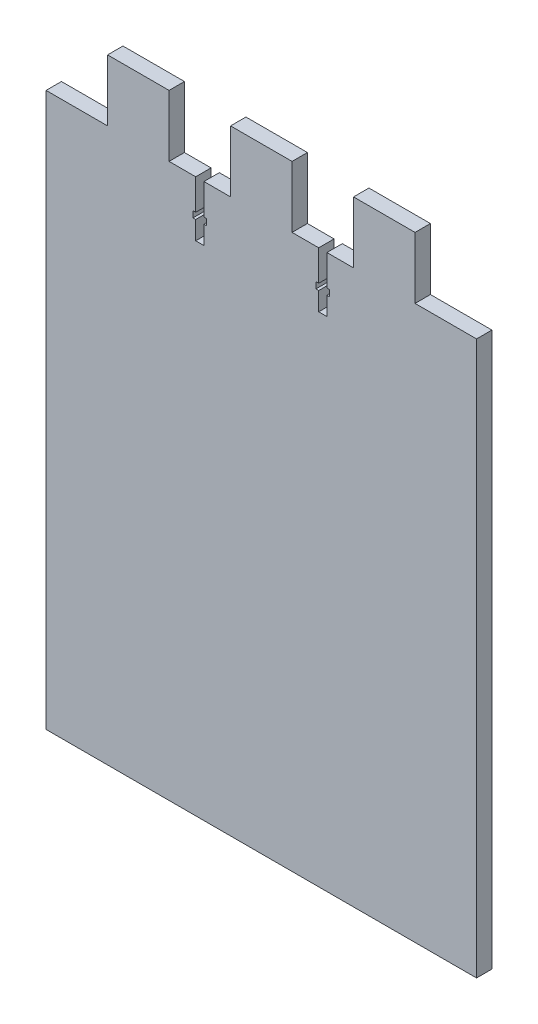
from build123d import *

# Parameters (mm, degrees)
SKETCH1_W           = 25.4
SKETCH1_H           = 25.4
BOSS_EXTRUDE1_DEPTH = 6.35


with BuildPart() as part:
    # Sketch1 → Boss-Extrude1 (new body)
    with BuildSketch(Plane.XY):
        with Locations((38.1, 241.3)):
            Rectangle(SKETCH1_W, SKETCH1_H)
        with Locations((88.9, 241.3)):
            Rectangle(SKETCH1_W, SKETCH1_H)
        with Locations((139.7, 241.3)):
            Rectangle(SKETCH1_W, SKETCH1_H)
        Polygon((0, 228.6), (0, 0), (177.8, 0), (177.8, 228.6), (152.4, 228.6), (127, 228.6), (116.0018, 228.6), (116.0018, 215.9), (117.1448, 215.9), (117.1448, 213.3092), (116.0018, 213.3092), (116.0018, 205.6892), (112.5982, 205.6892), (112.5982, 213.3092), (111.4552, 213.3092), (111.4552, 215.9), (112.5982, 215.9), (112.5982, 228.6), (101.6, 228.6), (76.2, 228.6), (65.2018, 228.6), (65.2018, 215.9), (66.3448, 215.9), (66.3448, 213.3092), (65.2018, 213.3092), (65.2018, 205.6892), (61.7982, 205.6892), (61.7982, 213.3092), (60.6552, 213.3092), (60.6552, 215.9), (61.7982, 215.9), (61.7982, 228.6), (50.8, 228.6), (25.4, 228.6), align=None)
    extrude(amount=BOSS_EXTRUDE1_DEPTH)


solid = part.part
